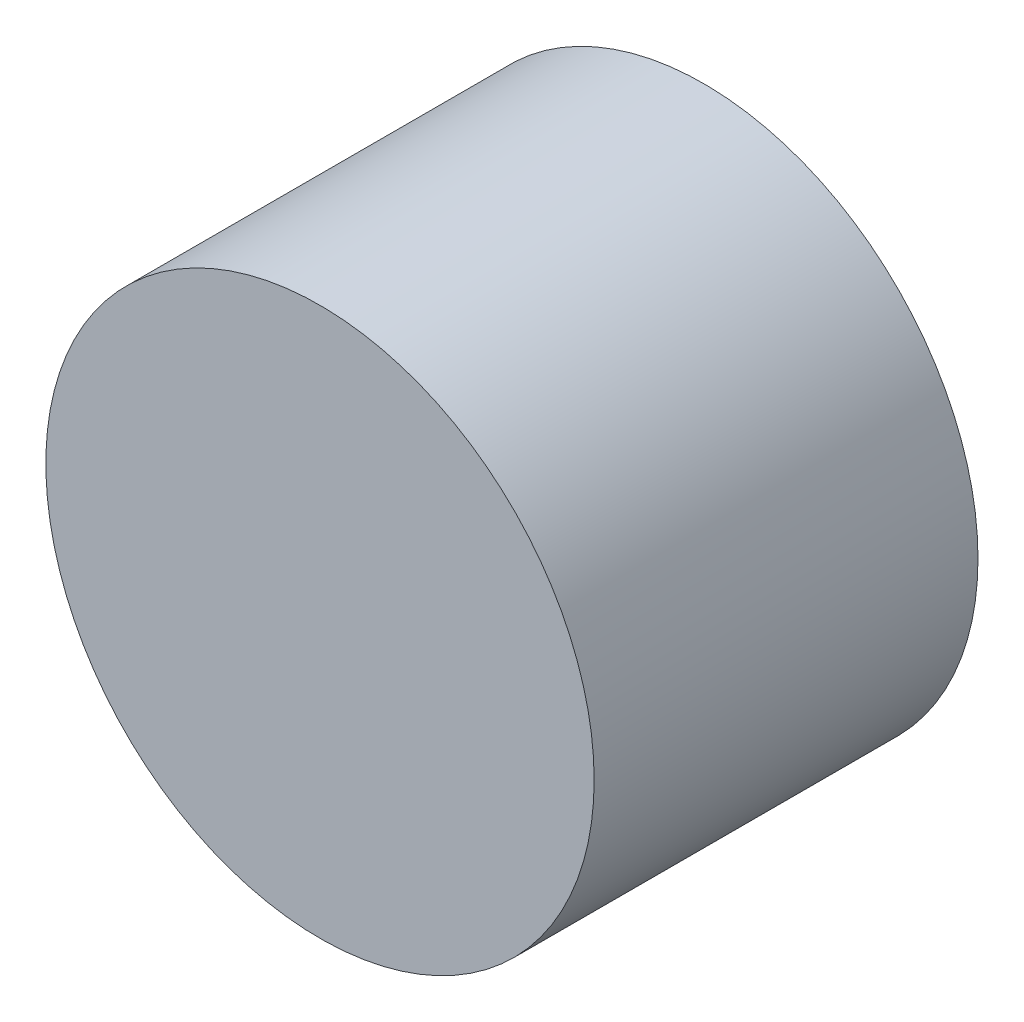
from build123d import *

# Parameters (mm, degrees)
CROQUIS1_R              = 15
SALIENTE_EXTRUIR1_DEPTH = 21


with BuildPart() as part:
    # Croquis1 → Saliente-Extruir1 (new body)
    with BuildSketch(Plane.XY):
        with Locations((-4.976335362, -25.8)):
            Circle(CROQUIS1_R)
    extrude(amount=SALIENTE_EXTRUIR1_DEPTH)


solid = part.part
